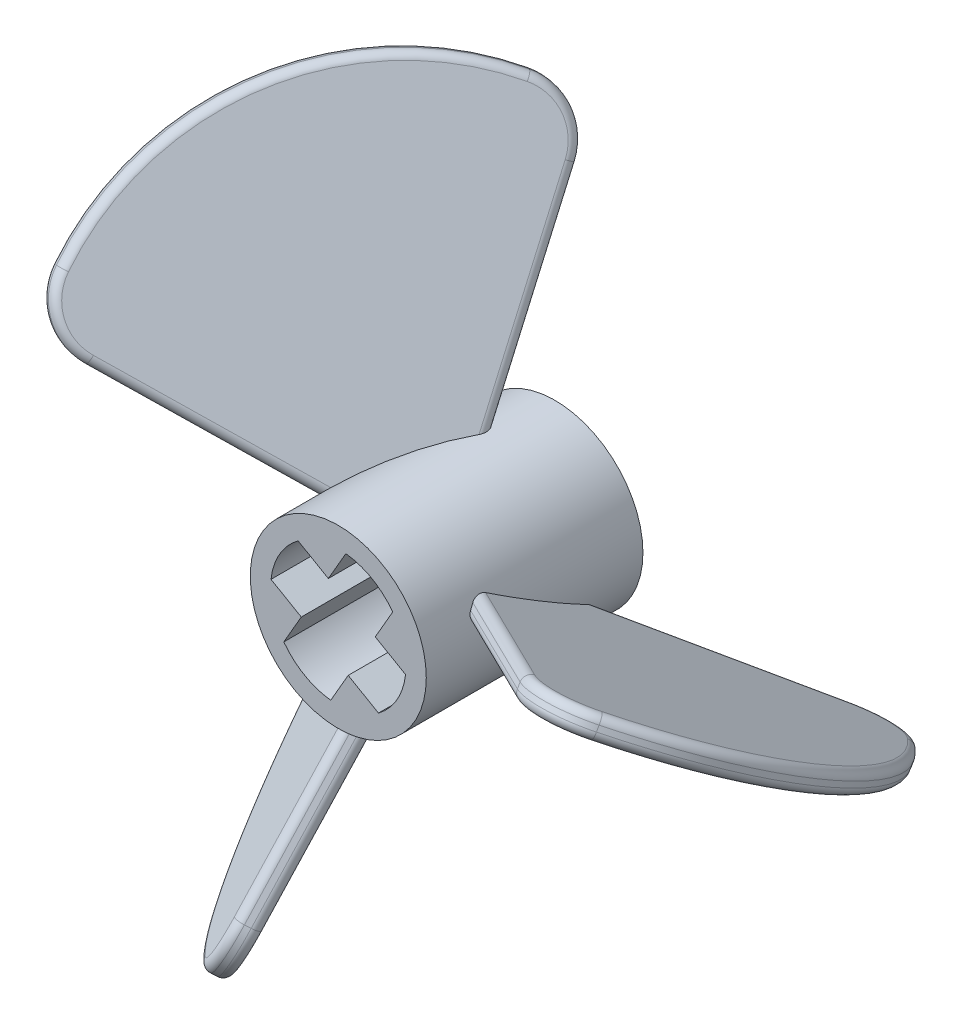
from build123d import *

# Parameters (mm, degrees)
SKETCH1_R                = 3.25
BOSS_EXTRUDE1_DEPTH      = 4
BOSS_EXTRUDE4_DEPTH      = 0.4
FILLET1_R                = 2
CIRPATTERN2_COUNT        = 3
FILLET1_OF_CIRPATTERN2_R = 2
CUT_EXTRUDE1_REACH       = 23.637
FILLET2_R                = 0.3


with BuildPart() as part:
    # Sketch1 → Boss-Extrude1 (new, symmetric)
    with BuildSketch(Plane.XY):
        Circle(SKETCH1_R)
    extrude(amount=BOSS_EXTRUDE1_DEPTH, both=True)

    # Sketch6 → Boss-Extrude4 (add, symmetric)
    with BuildSketch(Plane(origin=(0, 0, 0), x_dir=(-1, 0, 0), z_dir=(0, 0.866025403784438, -0.500000000000001))):
        with BuildLine():
            Line((0, 0), (-10, 8))
            ThreePointArc((-10, 8), (-14, 0), (-10, -8))
            Line((-10, -8), (0, 0))
        make_face()
    boss_extrude4 = extrude(amount=BOSS_EXTRUDE4_DEPTH, both=True)

    # Fillet1
    fillet1_edges = [part.edges().sort_by_distance(p)[0] for p in [
        (10, -4, -6.92820323),
        (10, 4, 6.92820323),
    ]]
    fillet(fillet1_edges, radius=FILLET1_R)

    # CirPattern2: Boss-Extrude4 ×3 about axis
    cirpattern2_axis = Axis((0, 0, 4), (0, 0, -1))
    for i in range(1, CIRPATTERN2_COUNT):
        add(boss_extrude4.rotate(cirpattern2_axis, i * 360 / CIRPATTERN2_COUNT))

    # Fillet1 of CirPattern2
    fillet1_of_cirpattern2_edges = [part.edges().sort_by_distance(p)[0] for p in [
        (-8.464101615, -6.660254038, -6.92820323),
        (-1.535898385, -10.660254038, 6.92820323),
        (-1.535898385, 10.660254038, -6.92820323),
        (-8.464101615, 6.660254038, 6.92820323),
    ]]
    fillet(fillet1_of_cirpattern2_edges, radius=FILLET1_OF_CIRPATTERN2_R)

    # Sketch7 → Cut-Extrude1 (cut, up to next)
    with BuildSketch(Plane.XY.offset(4), mode=Mode.PRIVATE) as cut_extrude1_sk1:
        with BuildLine():
            Line((0.27961852, 2.484313483), (-0.366025404, 1.366025404))
            Line((-0.366025404, 1.366025404), (-1.484313483, 2.011669328))
            ThreePointArc((-1.484313483, 2.011669328), (-2.165063509, 1.25), (-2.484313483, 0.27961852))
            Line((-2.484313483, 0.27961852), (-1.366025404, -0.366025404))
            Line((-1.366025404, -0.366025404), (-2.011669328, -1.484313483))
            ThreePointArc((-2.011669328, -1.484313483), (-1.25, -2.165063509), (-0.27961852, -2.484313483))
            Line((-0.27961852, -2.484313483), (0.366025404, -1.366025404))
            Line((0.366025404, -1.366025404), (1.484313483, -2.011669328))
            ThreePointArc((1.484313483, -2.011669328), (2.165063509, -1.25), (2.484313483, -0.27961852))
            Line((2.484313483, -0.27961852), (1.366025404, 0.366025404))
            Line((1.366025404, 0.366025404), (2.011669328, 1.484313483))
            ThreePointArc((2.011669328, 1.484313483), (1.25, 2.165063509), (0.27961852, 2.484313483))
        make_face()
    cut_extrude1_tool1 = extrude(cut_extrude1_sk1.sketch, amount=-CUT_EXTRUDE1_REACH, mode=Mode.PRIVATE) & part.part
    add(cut_extrude1_tool1.solids().sort_by_distance((0, 0, 4))[0], mode=Mode.SUBTRACT)

    # Fillet2
    fillet2_edges = [part.edges().sort_by_distance(p)[0] for p in [
        (-1.20587358, -6.114217695, 4.286257479),
        (-2.149245107, -10.400789842, 6.583480561),
        (-7.3, -11.951150572, 0.2),
        (-8.532725669, -6.715285621, -6.183480561),
        (-0.587527, -6.333289225, 3.803498858),
        (-1.549245107, -10.747200003, 6.183480561),
        (-6.7, -12.297560734, -0.2),
        (-7.932725669, -7.061695783, -6.583480561),
        (-5.191025858, 3.67545792, 3.803498858),
        (-8.532725669, 6.715285621, 6.183480561),
        (-7.3, 11.951150572, -0.2),
        (-1.20587358, 6.114217695, -4.286257479),
        (-0.587527, 6.333289225, -3.803498858),
        (-4.692131059, 4.101426001, 4.286257479),
        (-7.932725669, 7.061695783, 6.583480561),
        (-6.7, 12.297560734, 0.2),
        (5.778552858, -2.657831305, -3.803498858),
        (10.081970776, -4.031914382, -6.183480561),
        (14, -0.346410162, 0.2),
        (10.081970776, 3.339094059, 6.583480561),
        (5.898004638, -2.012791694, -4.286257479),
        (10.081970776, -3.339094059, -6.583480561),
        (14, 0.346410162, -0.2),
        (10.081970776, 4.031914382, 6.183480561),
        (-5.191025858, -3.67545792, -3.803498858),
        (-4.692131059, -4.101426001, -4.286257479),
        (-2.149245107, 10.400789842, -6.583480561),
        (-1.549245107, 10.747200003, -6.183480561),
        (5.898004638, 2.012791694, 4.286257479),
        (5.778552858, 2.657831305, 3.803498858),
    ]]
    fillet(fillet2_edges, radius=FILLET2_R)


solid = part.part
